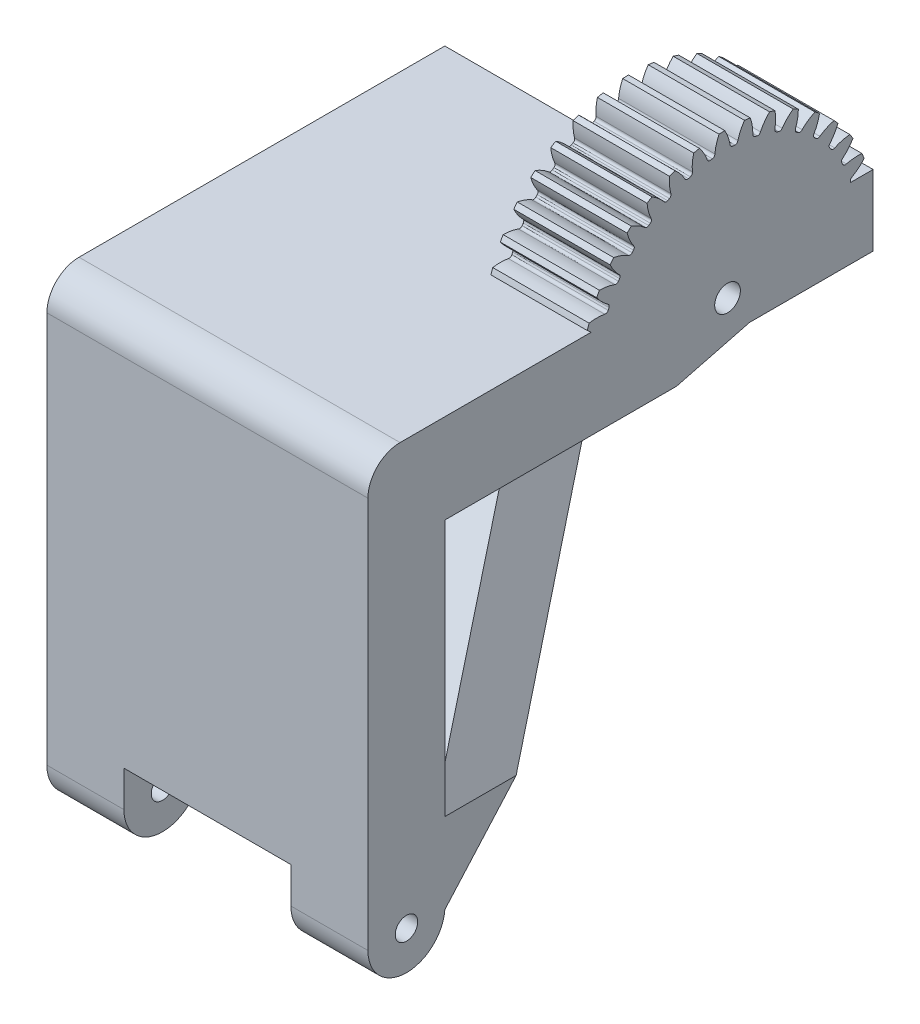
from build123d import *

# Parameters (mm, degrees)
BOSS_EXTRUDE1_DEPTH      = 47.5
BOSS_EXTRUDE1_DEPTH_BACK = 2.5
BOSS_EXTRUDE1_START      = 70
SKETCH2_R                = 1.749991042
SKETCH2_R_2              = 2.000000542
CUT_EXTRUDE1_DEPTH       = 311.590163462
CUT_EXTRUDE2_START       = 270.018646
CUT_EXTRUDE2_DEPTH       = 53
FILLET1_R                = 5
CUT_EXTRUDE3_DEPTH       = 314.871213788
BOSS_EXTRUDE2_DEPTH      = 15


with BuildPart() as part:
    # Sketch2 → Boss-Extrude1 (new, two sides: drawn at the far end of the back side and taken through both)
    with BuildSketch(Plane(origin=(0, 0, 0), x_dir=(0, 0, -1), z_dir=(1, 0, 0)).offset(BOSS_EXTRUDE1_START - BOSS_EXTRUDE1_DEPTH_BACK)):
        with BuildLine():
            Line((-282, -50), (-282, 16.00617549))
            Line((-282, 16.00617549), (-203.32772184, 16.00617549))
            Line((-203.32772184, 16.00617549), (-203.32772184, 4.993638415))
            Line((-203.32772184, 4.993638415), (-222.546576225, 4.993638415))
            Line((-222.546576225, 4.993638415), (-233.933118877, 2.071428354))
            Line((-233.933118877, 2.071428354), (-233.933118877, -9.676461133))
            Line((-233.933118877, -9.676461133), (-270.01864624, -50.472583771))
            ThreePointArc((-270.01864624, -50.472583771), (-276.236478609, -55.995334907), (-282, -50))
        make_face()
        with Locations((-276.000004168, -49.999991628)):
            Circle(SKETCH2_R, mode=Mode.SUBTRACT)
        with Locations((-226.000007629, 10.00000276)):
            Circle(SKETCH2_R_2, mode=Mode.SUBTRACT)
        Polygon((-270.01864624, 2.071428354), (-270.01864624, -35.815644584), (-240.365280151, -2.407390833), (-240.373748779, 1.861065388), align=None, mode=Mode.SUBTRACT)
    extrude(amount=BOSS_EXTRUDE1_DEPTH + BOSS_EXTRUDE1_DEPTH_BACK)

    # Sketch3 → Cut-Extrude1 (cut, through all)
    with BuildSketch(Plane.XY):
        Polygon((79.5, -55.891571045), (79.5, -57.717029151), (105.5, -57.717029151), (105.5, -55.891571045), (105.5, -44.409832001), (79.5, -44.409832001), align=None)
    extrude(amount=CUT_EXTRUDE1_DEPTH, mode=Mode.SUBTRACT)

    # Sketch4 → Cut-Extrude2 (cut)
    with BuildSketch(Plane.XY.offset(CUT_EXTRUDE2_START)):
        with BuildLine():
            Line((105.5, -44.409832001), (94.396057101, -22.201946203))
            ThreePointArc((94.396057101, -22.201946203), (92.5, -21.03011847), (90.603942899, -22.201946203))
            Line((90.603942899, -22.201946203), (79.5, -44.409832001))
            Line((79.5, -44.409832001), (105.5, -44.409832001))
        make_face()
        Polygon((97.5, 2.071428354), (117.5, -37.928571646), (117.5, 2.071428354), align=None)
        Polygon((87.5, 2.071428354), (67.5, 2.071428354), (67.5, -37.928571646), align=None)
    extrude(amount=-CUT_EXTRUDE2_DEPTH, mode=Mode.SUBTRACT)

    # Fillet1
    fillet1_edges = [part.edges().sort_by_distance(p)[0] for p in [
        (92.5, 16.00617549, 282),
    ]]
    fillet(fillet1_edges, radius=FILLET1_R)

    # Sketch5 → Cut-Extrude3 (cut, through all)
    with BuildSketch(Plane(origin=(0, 16.00617549, 0), x_dir=(1, 0, 0), z_dir=(0, 1, 0))):
        Polygon((65.025072437, -220.027445568), (95.5, -220.031402588), (102.5, -213.068008423), (102.5, -196.177042143), (65.025072437, -196.177042143), align=None)
    extrude(amount=-CUT_EXTRUDE3_DEPTH, mode=Mode.SUBTRACT)

    # Sketch7 → Boss-Extrude2 (add)
    with BuildSketch(Plane(origin=(117.5, 0, 0), x_dir=(0, 0, -1), z_dir=(1, 0, 0))):
        with BuildLine():
            Line((-247.249302419, 16.00617549), (-206.818352614, 16.00617549))
            ThreePointArc((-206.818352614, 16.00617549), (-206.832576029, 16.051412996), (-206.846906131, 16.096616819))
            add(Edge.make_bspline(
                [(-206.59811571, 16.641008158), (-206.936572327, 16.462467229), (-206.846906131, 16.096616819)],
                knots=[0, 0, 0, 1, 1, 1], degree=2))
            add(Edge.make_bspline(
                [(-204.7237122, 18.195077672), (-205.525462421, 17.256671604), (-206.59811571, 16.641008158)],
                knots=[0, 0, 0, 1, 1, 1], degree=2))
            ThreePointArc((-204.7237122, 18.195077672), (-204.805887516, 18.405314927), (-204.890140189, 18.61472833))
            ThreePointArc((-204.890140189, 18.61472833), (-204.97646196, 18.823297354), (-205.064844369, 19.031001557))
            add(Edge.make_bspline(
                [(-205.064844369, 19.031001557), (-206.294240862, 19.140516985), (-207.49138078, 18.829900546)],
                knots=[0, 0, 0, 1, 1, 1], degree=2))
            add(Edge.make_bspline(
                [(-207.49138078, 18.829900546), (-207.858117788, 18.720659016), (-208.050024499, 19.044786096)],
                knots=[0, 0, 0, 1, 1, 1], degree=2))
            ThreePointArc((-208.050024499, 19.044786096), (-208.122719215, 19.187633518), (-208.196550701, 19.329896724))
            add(Edge.make_bspline(
                [(-208.046072529, 19.909219539), (-208.348383923, 19.674618673), (-208.196550701, 19.329896724)],
                knots=[0, 0, 0, 1, 1, 1], degree=2))
            add(Edge.make_bspline(
                [(-206.47000676, 21.765165999), (-207.09662409, 20.701793962), (-208.046072529, 19.909219539)],
                knots=[0, 0, 0, 1, 1, 1], degree=2))
            ThreePointArc((-206.47000676, 21.765165999), (-206.587440964, 21.957939684), (-206.706777905, 22.149541303))
            ThreePointArc((-206.706777905, 22.149541303), (-206.828005886, 22.339952077), (-206.951113024, 22.529153342))
            add(Edge.make_bspline(
                [(-206.951113024, 22.529153342), (-208.180849376, 22.423522524), (-209.30586407, 21.909743881)],
                knots=[0, 0, 0, 1, 1, 1], degree=2))
            add(Edge.make_bspline(
                [(-209.30586407, 21.909743881), (-209.648059927, 21.738478762), (-209.893335219, 22.024357373)],
                knots=[0, 0, 0, 1, 1, 1], degree=2))
            ThreePointArc((-209.893335219, 22.024357373), (-209.989730735, 22.152411317), (-210.087144301, 22.279692523))
            add(Edge.make_bspline(
                [(-210.039550582, 22.876344383), (-210.296531173, 22.592811808), (-210.087144301, 22.279692523)],
                knots=[0, 0, 0, 1, 1, 1], degree=2))
            add(Edge.make_bspline(
                [(-208.809710513, 24.977775794), (-209.242155501, 23.821747811), (-210.039550582, 22.876344383)],
                knots=[0, 0, 0, 1, 1, 1], degree=2))
            ThreePointArc((-208.809710513, 24.977775794), (-208.958835427, 25.147228578), (-209.109630644, 25.315196695))
            ThreePointArc((-209.109630644, 25.315196695), (-209.262081383, 25.481663684), (-209.416172702, 25.646613226))
            add(Edge.make_bspline(
                [(-209.416172702, 25.646613226), (-210.608883996, 25.329045702), (-211.627590464, 24.627715759)],
                knots=[0, 0, 0, 1, 1, 1], degree=2))
            add(Edge.make_bspline(
                [(-211.627590464, 24.627715759), (-211.934847721, 24.399630856), (-212.226039031, 24.63857472)],
                knots=[0, 0, 0, 1, 1, 1], degree=2))
            ThreePointArc((-212.226039031, 24.63857472), (-212.343206416, 24.747944332), (-212.4612422, 24.856376161))
            add(Edge.make_bspline(
                [(-212.517979045, 25.452228101), (-212.721820609, 25.128378813), (-212.4612422, 24.856376161)],
                knots=[0, 0, 0, 1, 1, 1], degree=2))
            add(Edge.make_bspline(
                [(-211.671732746, 27.735293534), (-211.89686577, 26.52173493), (-212.517979045, 25.452228101)],
                knots=[0, 0, 0, 1, 1, 1], degree=2))
            ThreePointArc((-211.671732746, 27.735293534), (-211.848017284, 27.87627668), (-212.025688941, 28.01550767))
            ThreePointArc((-212.025688941, 28.01550767), (-212.204730299, 28.152972858), (-212.385123812, 28.288658769))
            add(Edge.make_bspline(
                [(-212.385123812, 28.288658769), (-213.50457012, 27.768803666), (-214.386015482, 26.90123198)],
                knots=[0, 0, 0, 1, 1, 1], degree=2))
            add(Edge.make_bspline(
                [(-214.386015482, 26.90123198), (-214.648998283, 26.623257536), (-214.977257909, 26.808006466)],
                knots=[0, 0, 0, 1, 1, 1], degree=2))
            ThreePointArc((-214.977257909, 26.808006466), (-215.111637092, 26.895368604), (-215.246708637, 26.981656412))
            add(Edge.make_bspline(
                [(-215.406052125, 27.558603772), (-215.550561039, 27.204277766), (-215.246708637, 26.981656412)],
                knots=[0, 0, 0, 1, 1, 1], degree=2))
            add(Edge.make_bspline(
                [(-214.96911236, 29.953933439), (-214.980092868, 28.719717577), (-215.406052125, 27.558603772)],
                knots=[0, 0, 0, 1, 1, 1], degree=2))
            ThreePointArc((-214.96911236, 29.953933439), (-215.167200207, 30.062163245), (-215.366349839, 30.168426644))
            ThreePointArc((-215.366349839, 30.168426644), (-215.566541737, 30.272713221), (-215.767756278, 30.375012754))
            add(Edge.make_bspline(
                [(-215.767756278, 30.375012754), (-216.77992379, 29.668665607), (-217.497325773, 28.661212903)],
                knots=[0, 0, 0, 1, 1, 1], degree=2))
            add(Edge.make_bspline(
                [(-217.497325773, 28.661212903), (-217.708043519, 28.341795031), (-218.063397459, 28.466735524)],
                knots=[0, 0, 0, 1, 1, 1], degree=2))
            ThreePointArc((-218.063397459, 28.466735524), (-218.210905396, 28.529435735), (-218.358908621, 28.590957709))
            add(Edge.make_bspline(
                [(-218.616017182, 29.131470237), (-218.696802615, 28.757433529), (-218.358908621, 28.590957709)],
                knots=[0, 0, 0, 1, 1, 1], degree=2))
            add(Edge.make_bspline(
                [(-218.601660145, 31.566283257), (-218.398154499, 30.348911162), (-218.616017182, 29.131470237)],
                knots=[0, 0, 0, 1, 1, 1], degree=2))
            ThreePointArc((-218.601660145, 31.566283257), (-218.815532501, 31.638471216), (-219.030109049, 31.708538265))
            ThreePointArc((-219.030109049, 31.708538265), (-219.245368756, 31.776477536), (-219.461290523, 31.842282371))
            add(Edge.make_bspline(
                [(-219.461290523, 31.842282371), (-220.335425042, 30.97090518), (-220.866985751, 29.854182399)],
                knots=[0, 0, 0, 1, 1, 1], degree=2))
            add(Edge.make_bspline(
                [(-220.866985751, 29.854182399), (-221.019035889, 29.50302645), (-221.390686893, 29.564362252)],
                knots=[0, 0, 0, 1, 1, 1], degree=2))
            ThreePointArc((-221.390686893, 29.564362252), (-221.54684163, 29.600495421), (-221.703279533, 29.635382248))
            add(Edge.make_bspline(
                [(-222.050341052, 30.123036743), (-222.06494838, 29.74065425), (-221.703279533, 29.635382248)],
                knots=[0, 0, 0, 1, 1, 1], degree=2))
            add(Edge.make_bspline(
                [(-222.459002975, 32.523352556), (-222.047194591, 31.359813463), (-222.050341052, 30.123036743)],
                knots=[0, 0, 0, 1, 1, 1], degree=2))
            ThreePointArc((-222.459002975, 32.523352556), (-222.682161437, 32.557305272), (-222.9056451, 32.589047019))
            ThreePointArc((-222.9056451, 32.589047019), (-223.129432059, 32.618574684), (-223.353500379, 32.645885374))
            add(Edge.make_bspline(
                [(-223.353500379, 32.645885374), (-224.063041769, 31.635954494), (-224.39261, 30.443892693)],
                knots=[0, 0, 0, 1, 1, 1], degree=2))
            add(Edge.make_bspline(
                [(-224.39261, 30.443892693), (-224.481372564, 30.071668363), (-224.858028205, 30.067535817)],
                knots=[0, 0, 0, 1, 1, 1], degree=2))
            ThreePointArc((-224.858028205, 30.067535817), (-225.01808506, 30.076004056), (-225.178204353, 30.083195717))
            add(Edge.make_bspline(
                [(-225.604673542, 30.503175044), (-225.552658929, 30.124065264), (-225.178204353, 30.083195717)],
                knots=[0, 0, 0, 1, 1, 1], degree=2))
            add(Edge.make_bspline(
                [(-226.423937439, 32.796061268), (-225.816338907, 31.721708724), (-225.604673542, 30.503175044)],
                knots=[0, 0, 0, 1, 1, 1], degree=2))
            ThreePointArc((-226.423937439, 32.796061268), (-226.64960145, 32.790747106), (-226.87520179, 32.783199093))
            ThreePointArc((-226.87520179, 32.783199093), (-227.100716348, 32.773417969), (-227.326123018, 32.761404693))
            add(Edge.make_bspline(
                [(-227.326123018, 32.761404693), (-227.849512223, 31.643606363), (-227.967074214, 30.412425737)],
                knots=[0, 0, 0, 1, 1, 1], degree=2))
            add(Edge.make_bspline(
                [(-227.967074214, 30.412425737), (-227.989852198, 30.030442873), (-228.360067984, 29.960967544)],
                knots=[0, 0, 0, 1, 1, 1], degree=2))
            ThreePointArc((-228.360067984, 29.960967544), (-228.51916371, 29.941513551), (-228.67809925, 29.920791531))
            add(Edge.make_bspline(
                [(-229.171018059, 30.26033483), (-229.053961943, 29.896016823), (-228.67809925, 29.920791531)],
                knots=[0, 0, 0, 1, 1, 1], degree=2))
            add(Edge.make_bspline(
                [(-230.375991011, 32.376123278), (-229.591063904, 31.423600941), (-229.171018059, 30.26033483)],
                knots=[0, 0, 0, 1, 1, 1], degree=2))
            ThreePointArc((-230.375991011, 32.376123278), (-230.597303884, 32.331703706), (-230.818166149, 32.285095276))
            ThreePointArc((-230.818166149, 32.285095276), (-231.038556159, 32.236302558), (-231.258452313, 32.185330332))
            add(Edge.make_bspline(
                [(-231.258452313, 32.185330332), (-231.579786416, 30.993628289), (-231.481770104, 29.760737638)],
                knots=[0, 0, 0, 1, 1, 1], degree=2))
            add(Edge.make_bspline(
                [(-231.481770104, 29.760737638), (-231.437871412, 29.380602596), (-231.790398523, 29.247895457)],
                knots=[0, 0, 0, 1, 1, 1], degree=2))
            ThreePointArc((-231.790398523, 29.247895457), (-231.943699078, 29.201110331), (-232.096621689, 29.153104258))
            add(Edge.make_bspline(
                [(-232.641013028, 29.401894679), (-232.462472099, 29.063438062), (-232.096621689, 29.153104258)],
                knots=[0, 0, 0, 1, 1, 1], degree=2))
            add(Edge.make_bspline(
                [(-234.195082542, 31.276298188), (-233.256676474, 30.474547968), (-232.641013028, 29.401894679)],
                knots=[0, 0, 0, 1, 1, 1], degree=2))
            ThreePointArc((-234.195082542, 31.276298188), (-234.405319797, 31.194122873), (-234.6147332, 31.1098702))
            ThreePointArc((-234.6147332, 31.1098702), (-234.823302224, 31.023548429), (-235.031006426, 30.93516602))
            add(Edge.make_bspline(
                [(-235.031006426, 30.93516602), (-235.140521855, 29.705769527), (-234.829905416, 28.508629609)],
                knots=[0, 0, 0, 1, 1, 1], degree=2))
            add(Edge.make_bspline(
                [(-234.829905416, 28.508629609), (-234.720663886, 28.141892601), (-235.044790966, 27.94998589)],
                knots=[0, 0, 0, 1, 1, 1], degree=2))
            ThreePointArc((-235.044790966, 27.94998589), (-235.187638388, 27.877291174), (-235.329901594, 27.803459688))
            add(Edge.make_bspline(
                [(-235.909224409, 27.95393786), (-235.674623543, 27.651626466), (-235.329901594, 27.803459688)],
                knots=[0, 0, 0, 1, 1, 1], degree=2))
            add(Edge.make_bspline(
                [(-237.765170868, 29.530003629), (-236.701798832, 28.903386299), (-235.909224409, 27.95393786)],
                knots=[0, 0, 0, 1, 1, 1], degree=2))
            ThreePointArc((-237.765170868, 29.530003629), (-237.957944553, 29.412569424), (-238.149546173, 29.293232484))
            ThreePointArc((-238.149546173, 29.293232484), (-238.339956947, 29.172004503), (-238.529158211, 29.048897365))
            add(Edge.make_bspline(
                [(-238.529158211, 29.048897365), (-238.423527394, 27.819161013), (-237.909748751, 26.694146319)],
                knots=[0, 0, 0, 1, 1, 1], degree=2))
            add(Edge.make_bspline(
                [(-237.909748751, 26.694146319), (-237.738483632, 26.351950462), (-238.024362243, 26.10667517)],
                knots=[0, 0, 0, 1, 1, 1], degree=2))
            ThreePointArc((-238.024362243, 26.10667517), (-238.152416187, 26.010279654), (-238.279697393, 25.912866088))
            add(Edge.make_bspline(
                [(-238.876349252, 25.960459807), (-238.592816678, 25.703479216), (-238.279697393, 25.912866088)],
                knots=[0, 0, 0, 1, 1, 1], degree=2))
            add(Edge.make_bspline(
                [(-240.977780663, 27.190299876), (-239.82175268, 26.757854888), (-238.876349252, 25.960459807)],
                knots=[0, 0, 0, 1, 1, 1], degree=2))
            ThreePointArc((-240.977780663, 27.190299876), (-241.147233447, 27.041174962), (-241.315201565, 26.890379745))
            ThreePointArc((-241.315201565, 26.890379745), (-241.481668554, 26.737929006), (-241.646618096, 26.583837687))
            add(Edge.make_bspline(
                [(-241.646618096, 26.583837687), (-241.329050571, 25.391126392), (-240.627720629, 24.372419924)],
                knots=[0, 0, 0, 1, 1, 1], degree=2))
            add(Edge.make_bspline(
                [(-240.627720629, 24.372419924), (-240.399635725, 24.065162668), (-240.63857959, 23.773971358)],
                knots=[0, 0, 0, 1, 1, 1], degree=2))
            ThreePointArc((-240.63857959, 23.773971358), (-240.747949202, 23.656803973), (-240.856381031, 23.538768189))
            add(Edge.make_bspline(
                [(-241.452232971, 23.482031344), (-241.128383682, 23.27818978), (-240.856381031, 23.538768189)],
                knots=[0, 0, 0, 1, 1, 1], degree=2))
            add(Edge.make_bspline(
                [(-243.735298404, 24.328277643), (-242.521739799, 24.103144619), (-241.452232971, 23.482031344)],
                knots=[0, 0, 0, 1, 1, 1], degree=2))
            ThreePointArc((-243.735298404, 24.328277643), (-243.87628155, 24.151993104), (-244.01551254, 23.974321448))
            ThreePointArc((-244.01551254, 23.974321448), (-244.152977728, 23.795280089), (-244.288663639, 23.614886577))
            add(Edge.make_bspline(
                [(-244.288663639, 23.614886577), (-243.768808536, 22.495440269), (-242.90123685, 21.613994907)],
                knots=[0, 0, 0, 1, 1, 1], degree=2))
            add(Edge.make_bspline(
                [(-242.90123685, 21.613994907), (-242.623262405, 21.351012106), (-242.808011336, 21.02275248)],
                knots=[0, 0, 0, 1, 1, 1], degree=2))
            ThreePointArc((-242.808011336, 21.02275248), (-242.895373474, 20.888373297), (-242.981661282, 20.753301752))
            add(Edge.make_bspline(
                [(-243.558608642, 20.593958264), (-243.204282636, 20.44944935), (-242.981661282, 20.753301752)],
                knots=[0, 0, 0, 1, 1, 1], degree=2))
            add(Edge.make_bspline(
                [(-245.953938309, 21.030898029), (-244.719722447, 21.019917521), (-243.558608642, 20.593958264)],
                knots=[0, 0, 0, 1, 1, 1], degree=2))
            ThreePointArc((-245.953938309, 21.030898029), (-246.062168115, 20.832810182), (-246.168431514, 20.63366055))
            ThreePointArc((-246.168431514, 20.63366055), (-246.272718091, 20.433468652), (-246.375017624, 20.232254111))
            add(Edge.make_bspline(
                [(-246.375017624, 20.232254111), (-245.668670477, 19.220086599), (-244.661217773, 18.502684616)],
                knots=[0, 0, 0, 1, 1, 1], degree=2))
            add(Edge.make_bspline(
                [(-244.661217773, 18.502684616), (-244.341799901, 18.29196687), (-244.466740394, 17.93661293)],
                knots=[0, 0, 0, 1, 1, 1], degree=2))
            ThreePointArc((-244.466740394, 17.93661293), (-244.529440605, 17.789104993), (-244.590962579, 17.641101768))
            add(Edge.make_bspline(
                [(-245.131475107, 17.383993207), (-244.757438399, 17.303207774), (-244.590962579, 17.641101768)],
                knots=[0, 0, 0, 1, 1, 1], degree=2))
            add(Edge.make_bspline(
                [(-247.566288127, 17.398350244), (-246.348916032, 17.60185589), (-245.131475107, 17.383993207)],
                knots=[0, 0, 0, 1, 1, 1], degree=2))
            ThreePointArc((-247.566288127, 17.398350244), (-247.638476086, 17.184477888), (-247.708543134, 16.96990134))
            ThreePointArc((-247.708543134, 16.96990134), (-247.776482406, 16.754641633), (-247.84228724, 16.538719866))
            add(Edge.make_bspline(
                [(-247.84228724, 16.538719866), (-247.558780453, 16.254315972), (-247.249302419, 16.00617549)],
                knots=[0, 0, 0, 0.325354841, 0.325354841, 0.325354841], degree=2))
        make_face()
    extrude(amount=-BOSS_EXTRUDE2_DEPTH)


solid = part.part
